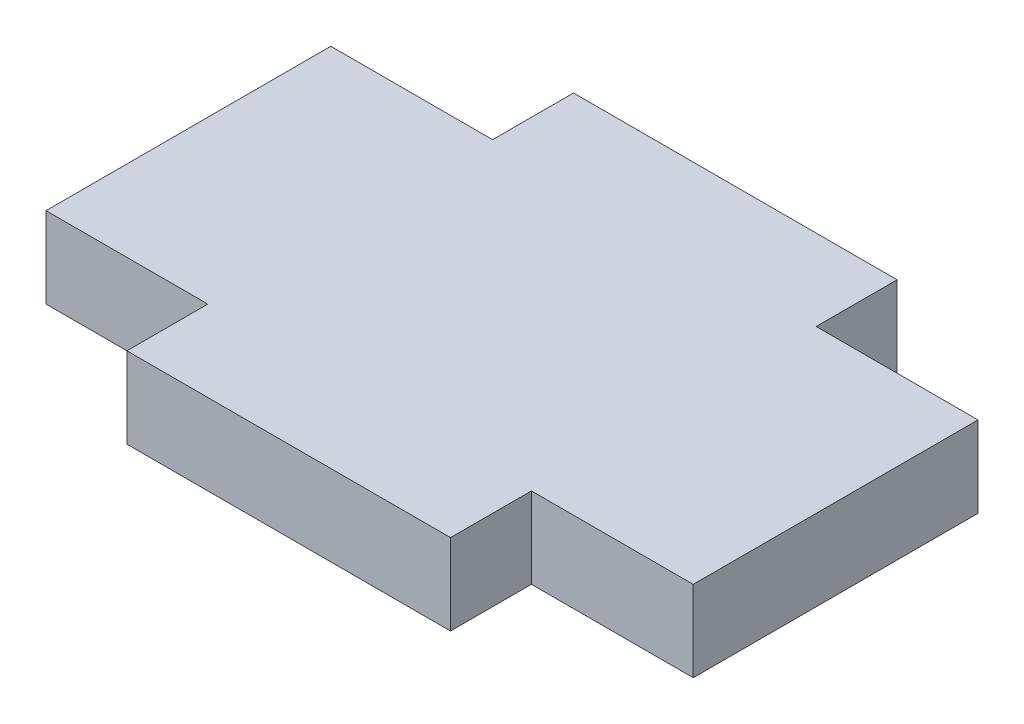
from build123d import *

# Parameters (mm, degrees)
SKETCH1_W           = 12.7
SKETCH1_H           = 3.175
SKETCH1_W_2         = 6.35
BOSS_EXTRUDE1_DEPTH = 3.175


with BuildPart() as part:
    # Sketch1 → Boss-Extrude1 (new body)
    with BuildSketch(Plane(origin=(0, 0, 0), x_dir=(1, 0, 0), z_dir=(0, 1, 0))):
        Polygon((0, 11.176), (0, 0), (6.35, 0), (19.05, 0), (25.4, 0), (25.4, 11.176), (19.05, 11.176), (12.7, 11.176), (6.35, 11.176), align=None)
        with Locations((12.7, -1.5875)):
            Rectangle(SKETCH1_W, SKETCH1_H)
        with Locations((15.875, 12.7635)):
            Rectangle(SKETCH1_W_2, SKETCH1_H)
        with Locations((9.525, 12.7635)):
            Rectangle(SKETCH1_W_2, SKETCH1_H)
    extrude(amount=BOSS_EXTRUDE1_DEPTH)


solid = part.part
